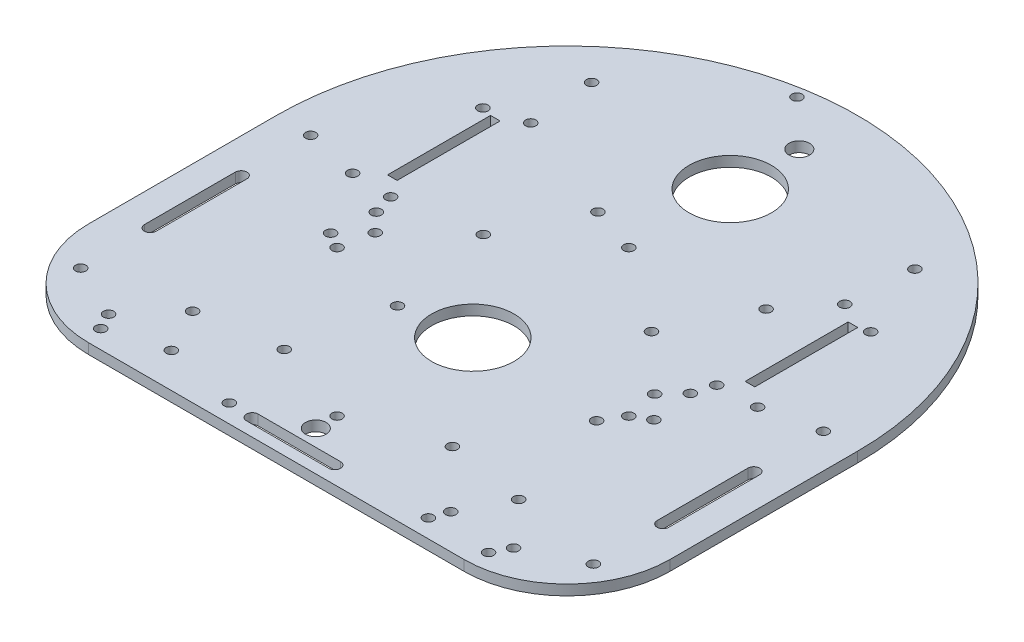
from build123d import *

# Parameters (mm, degrees)
SKETCH1_R           = 1.5
SKETCH1_R_2         = 3
SKETCH1_R_3         = 12
SKETCH1_W           = 2.8
SKETCH1_H           = 30
BOSS_EXTRUDE4_DEPTH = 3


with BuildPart() as part:
    # Sketch1 → Boss-Extrude4 (new body)
    with BuildSketch(Plane(origin=(0, 0, 0), x_dir=(1, 0, 0), z_dir=(0, 1, 0))):
        with BuildLine():
            Line((-121.196449229, -126.808304592), (-11.829794241, -126.808304592))
            ThreePointArc((-11.829794241, -126.808304592), (9.383409194, -118.021508028), (18.170205759, -96.808304592))
            Line((18.170205759, -96.808304592), (18.170205759, -42.124977099))
            ThreePointArc((18.170205759, -42.124977099), (-66.513121735, 42.558350395), (-151.196449229, -42.124977099))
            Line((-151.196449229, -42.124977099), (-151.196449229, -96.808304592))
            ThreePointArc((-151.196449229, -96.808304592), (-142.409652664, -118.021508028), (-121.196449229, -126.808304592))
        make_face()
        with Locations(Location((-19.417066349, 12.133998526, 0), (0, 0, 270))):
            Circle(SKETCH1_R, mode=Mode.SUBTRACT)
        with Locations(Location((-19.417066349, -63.912266725, 0), (0, 0, 270))):
            Circle(SKETCH1_R, mode=Mode.SUBTRACT)
        with Locations(Location((-113.609177122, -63.912266725, 0), (0, 0, 270))):
            Circle(SKETCH1_R, mode=Mode.SUBTRACT)
        with Locations(Location((-113.609177122, 12.133998526, 0), (0, 0, 270))):
            Circle(SKETCH1_R, mode=Mode.SUBTRACT)
        with Locations(Location((-20.763121735, -6.941649605, 0), (0, 0, 270))):
            Circle(SKETCH1_R, mode=Mode.SUBTRACT)
        with Locations(Location((-112.263121735, -6.941649605, 0), (0, 0, 270))):
            Circle(SKETCH1_R, mode=Mode.SUBTRACT)
        with Locations(Location((-112.263121735, -51.941649605, 0), (0, 0, 270))):
            Circle(SKETCH1_R, mode=Mode.SUBTRACT)
        with Locations(Location((-66.513121735, -115.308304592, 0), (0, 0, 270))):
            Circle(SKETCH1_R_2, mode=Mode.SUBTRACT)
        with Locations(Location((8.170205759, -42.124977099, 0), (0, 0, 270))):
            Circle(SKETCH1_R, mode=Mode.SUBTRACT)
        with Locations(Location((-141.196449229, -42.124977099, 0), (0, 0, 270))):
            Circle(SKETCH1_R, mode=Mode.SUBTRACT)
        with Locations(Location((-66.513121735, 5.435278237, 0), (0, 0, 270))):
            Circle(SKETCH1_R_3, mode=Mode.SUBTRACT)
        with Locations(Location((-66.513121735, 25.558350395, 0), (0, 0, 270))):
            Circle(SKETCH1_R_2, mode=Mode.SUBTRACT)
        with Locations(Location((-66.513121735, -69.564721763, 0), (0, 0, 270))):
            Circle(SKETCH1_R_3, mode=Mode.SUBTRACT)
        with Locations(Location((-107.213121735, -116.69721419, 0), (0, 0, 270))):
            Circle(SKETCH1_R, mode=Mode.SUBTRACT)
        with Locations(Location((-25.813121735, -116.69721419, 0), (0, 0, 270))):
            Circle(SKETCH1_R, mode=Mode.SUBTRACT)
        with Locations(Location((-25.813121735, -57.29721419, 0), (0, 0, 270))):
            Circle(SKETCH1_R, mode=Mode.SUBTRACT)
        with Locations(Location((-123.013121735, -10.138406212, 0), (0, 0, 270))):
            Circle(SKETCH1_R, mode=Mode.SUBTRACT)
        with Locations(Location((-107.213121735, -57.29721419, 0), (0, 0, 270))):
            Circle(SKETCH1_R, mode=Mode.SUBTRACT)
        with Locations(Location((-114.013120412, -46.008407352, 0), (0, 0, 270))):
            Circle(SKETCH1_R, mode=Mode.SUBTRACT)
        with Locations(Location((-19.013119912, -46.008407352, 0), (0, 0, 270))):
            Circle(SKETCH1_R, mode=Mode.SUBTRACT)
        with Locations(Location((-19.013119912, -103.708406252, 0), (0, 0, 270))):
            Circle(SKETCH1_R, mode=Mode.SUBTRACT)
        with Locations(Location((-114.013120412, -103.708406252, 0), (0, 0, 270))):
            Circle(SKETCH1_R, mode=Mode.SUBTRACT)
        with Locations(Location((-10.013121735, -10.138406212, 0), (0, 0, 270))):
            Circle(SKETCH1_R, mode=Mode.SUBTRACT)
        with Locations(Location((-10.013121735, -121.478406212, 0), (0, 0, 270))):
            Circle(SKETCH1_R, mode=Mode.SUBTRACT)
        with Locations(Location((-123.013121735, -121.478406212, 0), (0, 0, 270))):
            Circle(SKETCH1_R, mode=Mode.SUBTRACT)
        with Locations(Location((-125.513121735, -116.69721419, 0), (0, 0, 270))):
            Circle(SKETCH1_R, mode=Mode.SUBTRACT)
        with Locations(Location((-125.513121735, -45.59721419, 0), (0, 0, 270))):
            Circle(SKETCH1_R, mode=Mode.SUBTRACT)
        with Locations(Location((-7.513121735, -116.69721419, 0), (0, 0, 270))):
            Circle(SKETCH1_R, mode=Mode.SUBTRACT)
        with Locations(Location((-7.513121735, -45.59721419, 0), (0, 0, 270))):
            Circle(SKETCH1_R, mode=Mode.SUBTRACT)
        with Locations(Location((-80.013121735, 38.378834062, 0), (0, 0, 270))):
            Circle(SKETCH1_R, mode=Mode.SUBTRACT)
        with Locations(Location((-80.013121735, -19.621165938, 0), (0, 0, 270))):
            Circle(SKETCH1_R, mode=Mode.SUBTRACT)
        with Locations(Location((-31.013121735, -19.621165938, 0), (0, 0, 270))):
            Circle(SKETCH1_R, mode=Mode.SUBTRACT)
        with Locations(Location((-27.513121735, -72.508406212, 0), (0, 0, 270))):
            Circle(SKETCH1_R, mode=Mode.SUBTRACT)
        with Locations(Location((-27.513121735, -121.508406212, 0), (0, 0, 270))):
            Circle(SKETCH1_R, mode=Mode.SUBTRACT)
        with Locations(Location((-85.513121735, -72.508406212, 0), (0, 0, 270))):
            Circle(SKETCH1_R, mode=Mode.SUBTRACT)
        with Locations(Location((-85.513121735, -121.508406212, 0), (0, 0, 270))):
            Circle(SKETCH1_R, mode=Mode.SUBTRACT)
        with Locations(Location((-42.013121735, -100.008406212, 0), (0, 0, 270))):
            Circle(SKETCH1_R, mode=Mode.SUBTRACT)
        with Locations(Location((-91.013121735, -100.008406212, 0), (0, 0, 270))):
            Circle(SKETCH1_R, mode=Mode.SUBTRACT)
        with Locations(Location((-42.013121735, -42.008406212, 0), (0, 0, 270))):
            Circle(SKETCH1_R, mode=Mode.SUBTRACT)
        with Locations(Location((-91.013121735, -42.008406212, 0), (0, 0, 270))):
            Circle(SKETCH1_R, mode=Mode.SUBTRACT)
        with Locations(Location((-66.513121735, -109.124977099, 0), (0, 0, 270))):
            Circle(SKETCH1_R, mode=Mode.SUBTRACT)
        with Locations(Location((-66.513121735, -24.124977099, 0), (0, 0, 270))):
            Circle(SKETCH1_R, mode=Mode.SUBTRACT)
        with Locations(Location((-24.013121735, -66.624977099, 0), (0, 0, 270))):
            Circle(SKETCH1_R, mode=Mode.SUBTRACT)
        with Locations(Location((-109.013121735, -66.624977099, 0), (0, 0, 270))):
            Circle(SKETCH1_R, mode=Mode.SUBTRACT)
        with Locations(Location((-141.196449229, -109.124977099, 0), (0, 0, 270))):
            Circle(SKETCH1_R, mode=Mode.SUBTRACT)
        with Locations(Location((8.170205759, -109.124977099, 0), (0, 0, 270))):
            Circle(SKETCH1_R, mode=Mode.SUBTRACT)
        with Locations(Location((-20.763121735, -51.941649605, 0), (0, 0, 270))):
            Circle(SKETCH1_R, mode=Mode.SUBTRACT)
        with BuildLine():
            Line((-139.496449229, -88.862296701), (-139.496449229, -62.387657497))
            ThreePointArc((-139.496449229, -62.387657497), (-141.196449229, -60.687657497), (-142.896449229, -62.387657497))
            Line((-142.896449229, -62.387657497), (-142.896449229, -88.862296701))
            ThreePointArc((-142.896449229, -88.862296701), (-141.196449229, -90.562296701), (-139.496449229, -88.862296701))
        make_face(mode=Mode.SUBTRACT)
        with BuildLine():
            Line((-78.513121735, -120.108304592), (-54.513121735, -120.108304592))
            ThreePointArc((-54.513121735, -120.108304592), (-52.813121735, -121.808304592), (-54.513121735, -123.508304592))
            Line((-54.513121735, -123.508304592), (-78.513121735, -123.508304592))
            ThreePointArc((-78.513121735, -123.508304592), (-80.213121735, -121.808304592), (-78.513121735, -120.108304592))
        make_face(mode=Mode.SUBTRACT)
        with Locations((-14.413121735, -25.911649605)):
            Rectangle(SKETCH1_W, SKETCH1_H, mode=Mode.SUBTRACT)
        with Locations((-118.613121735, -25.911649605)):
            Rectangle(SKETCH1_W, SKETCH1_H, mode=Mode.SUBTRACT)
        with BuildLine():
            Line((9.870205759, -88.862296701), (9.870205759, -62.387657497))
            ThreePointArc((9.870205759, -62.387657497), (8.170205759, -60.687657497), (6.470205759, -62.387657497))
            Line((6.470205759, -62.387657497), (6.470205759, -88.862296701))
            ThreePointArc((6.470205759, -88.862296701), (8.170205759, -90.562296701), (9.870205759, -88.862296701))
        make_face(mode=Mode.SUBTRACT)
    extrude(amount=BOSS_EXTRUDE4_DEPTH)


solid = part.part
